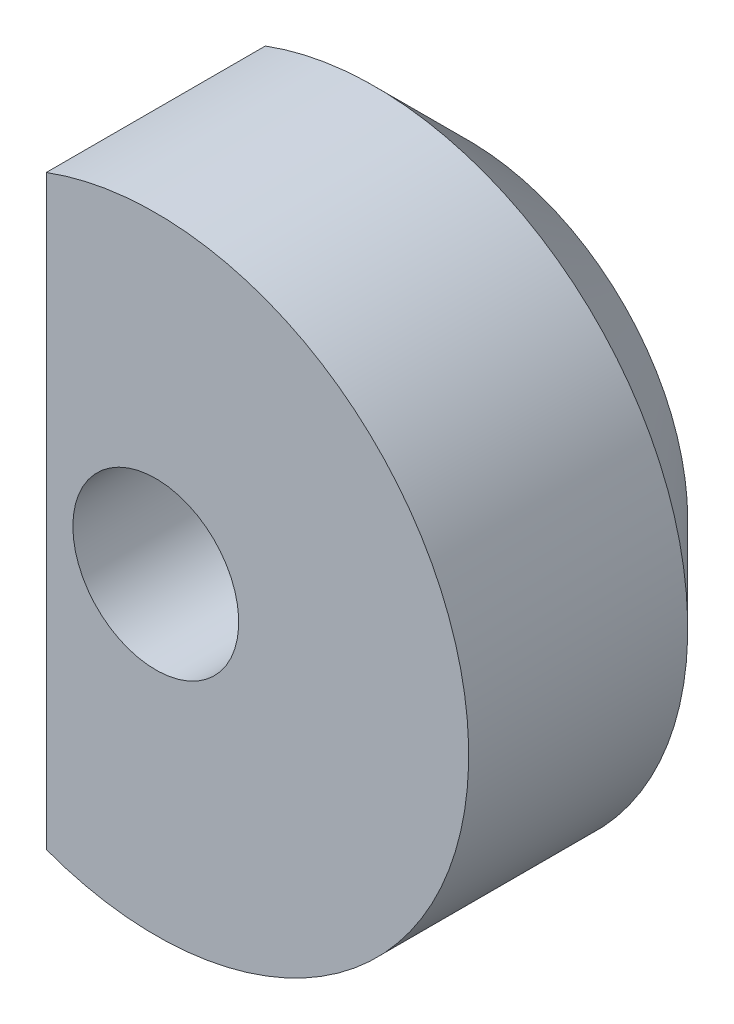
from build123d import *

# Parameters (mm, degrees)
BOSS_EXTRUDE1_DEPTH                     = 10
CBORE_FOR_M5_HEX_HEAD_BOLT1_D           = 5.3
CBORE_FOR_M5_HEX_HEAD_BOLT1_CBORE_D     = 12.24
CBORE_FOR_M5_HEX_HEAD_BOLT1_CBORE_DEPTH = 3.58
CHAMFER1_SIZE                           = 3


with BuildPart() as part:
    # Sketch1 → Boss-Extrude1 (new body)
    with BuildSketch(Plane.XY):
        with BuildLine():
            Line((-3.5, 9.367496998), (-3.5, -9.367496998))
            ThreePointArc((-3.5, -9.367496998), (10, 0), (-3.5, 9.367496998))
        make_face()
    extrude(amount=BOSS_EXTRUDE1_DEPTH)

    # CBORE for M5 Hex Head Bolt1 (through all)
    with Locations(Plane(origin=(0, 0, 0), x_dir=(-1, 0, 0), z_dir=(0, 0, -1))):
        with Locations((0, 0)):
            CounterBoreHole(CBORE_FOR_M5_HEX_HEAD_BOLT1_D / 2, CBORE_FOR_M5_HEX_HEAD_BOLT1_CBORE_D / 2, CBORE_FOR_M5_HEX_HEAD_BOLT1_CBORE_DEPTH)

    # Chamfer1
    chamfer1_edges = [part.edges().sort_by_distance(p)[0] for p in [
        (10, 0, 0),
    ]]
    chamfer(chamfer1_edges, length=CHAMFER1_SIZE)


solid = part.part
